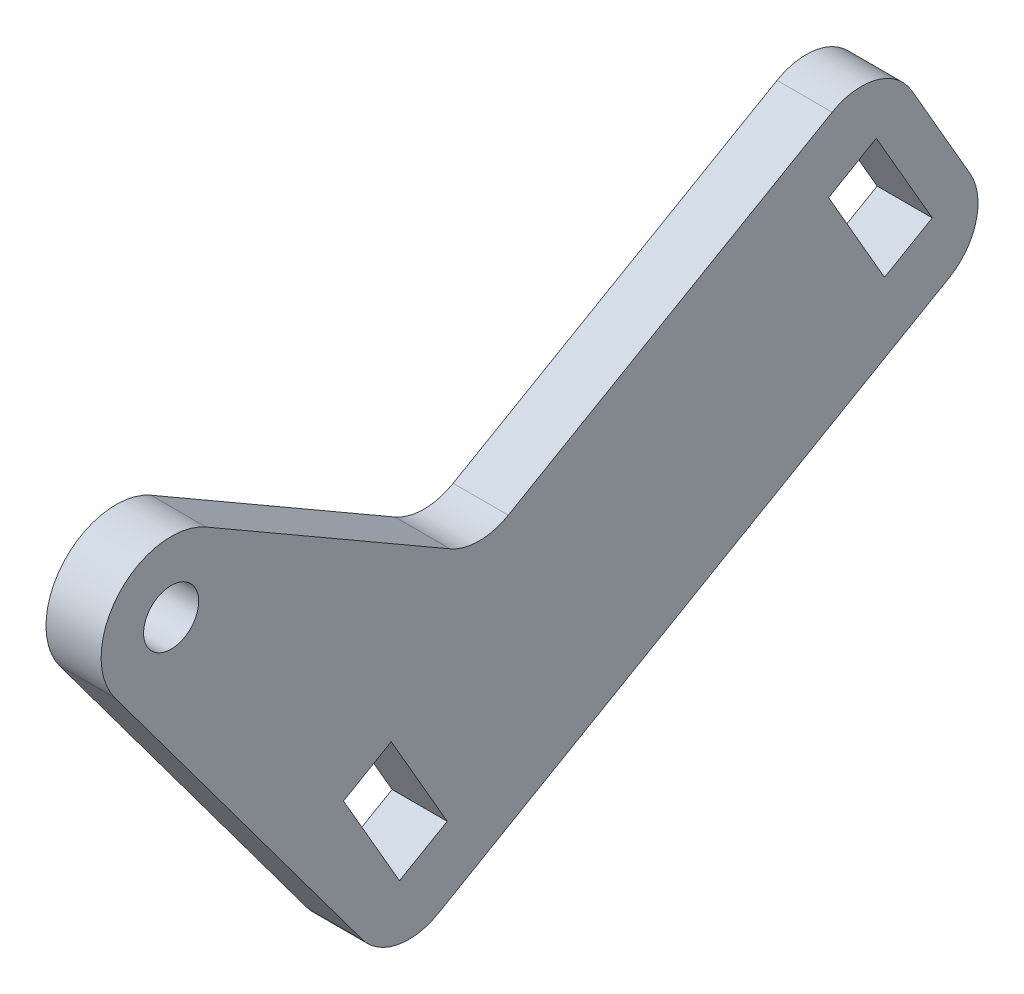
from build123d import *

# Parameters (mm, degrees)
BOSS_EXTRUDE1_DEPTH = 1.499997
SKETCH3_R           = 3.81
SKETCH3_R_2         = 1.5
BOSS_EXTRUDE2_DEPTH = 1.499997
BOSS_EXTRUDE3_DEPTH = 2.999994
FILLET1_R           = 3.175


with BuildPart() as part:
    # Sketch2 → Boss-Extrude1 (new, symmetric)
    with BuildSketch(Plane(origin=(0, 0, 0), x_dir=(0, 0, -1), z_dir=(1, 0, 0))):
        Polygon((-19.672783942, -4.025738686), (13.322783942, 15.024261314), (19.672783942, 4.025738686), (-13.322783942, -15.024261314), align=None)
        Polygon((-16.021265259, -5.730354569), (-12.973265259, -11.009645431), (-10.375189048, -9.509645431), (-13.423189048, -4.230354569), align=None, mode=Mode.SUBTRACT)
        Polygon((10.375189048, 9.509645431), (13.423189048, 4.230354569), (16.021265259, 5.730354569), (12.973265259, 11.009645431), align=None, mode=Mode.SUBTRACT)
    extrude(amount=BOSS_EXTRUDE1_DEPTH, both=True)



with BuildPart() as body_2:
    # Sketch3 → Boss-Extrude2 (new, symmetric)
    with BuildSketch(Plane(origin=(0, 0, 0), x_dir=(0, 0, -1), z_dir=(1, 0, 0))):
        with Locations((-25.4, 7.62)):
            Circle(SKETCH3_R)
        with Locations((-25.4, 7.62)):
            Circle(SKETCH3_R_2, mode=Mode.SUBTRACT)
    extrude(amount=BOSS_EXTRUDE2_DEPTH, both=True)


with BuildPart() as part_1:
    add(part.part)

    add(body_2.part)  # Boss-Extrude3 merges body 2
    # Sketch4 → Boss-Extrude3 (add)
    with BuildSketch(Plane(origin=(1.499997, 0, 0), x_dir=(0, 0, -1), z_dir=(1, 0, 0))):
        with BuildLine():
            Line((-28.458311324, 5.347813422), (-13.322783942, -15.024261314))
            Line((-13.322783942, -15.024261314), (-19.672783942, -4.025738686))
            Line((-19.672783942, -4.025738686), (-8.640886423, 2.343530316))
            Line((-8.640886423, 2.343530316), (-23.495, 10.919556788))
            ThreePointArc((-23.495, 10.919556788), (-22.100443212, 9.525), (-21.59, 7.62))
            ThreePointArc((-21.59, 7.62), (-24.203351794, 4.002800383), (-28.458311324, 5.347813422))
        make_face()
    extrude(amount=-BOSS_EXTRUDE3_DEPTH)

    # Fillet1
    fillet1_edges = [part_1.edges().sort_by_distance(p)[0] for p in [
        (0, 2.343530316, 8.640886423),
        (0, 15.024261314, -13.322783942),
        (0, 4.025738686, -19.672783942),
        (0, -15.024261314, 13.322783942),
    ]]
    fillet(fillet1_edges, radius=FILLET1_R)


solid = part_1.part
